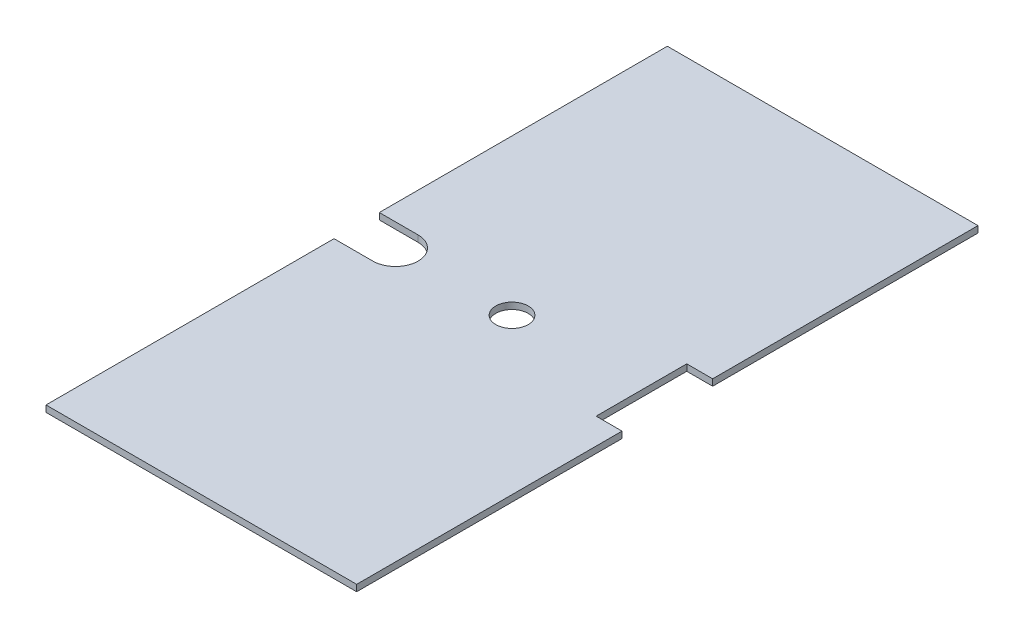
from build123d import *

# Parameters (mm, degrees)
SKETCH1_W           = 609.6
SKETCH1_H           = 1219.2
BOSS_EXTRUDE1_DEPTH = 12.7
SKETCH6_R           = 31.75
CUT_EXTRUDE3_DEPTH  = 682.671834536
SKETCH8_W           = 415.926094716
SKETCH8_H           = 177.8
CUT_EXTRUDE4_DEPTH  = 682.671834536
SKETCH10_W          = 180.418217341
SKETCH10_H          = 88.9
CUT_EXTRUDE7_DEPTH  = 682.671834536
SKETCH14_R          = 44.45
CUT_EXTRUDE8_DEPTH  = 682.671834536


with BuildPart() as part:
    # Sketch1 → Boss-Extrude1 (new body)
    with BuildSketch(Plane(origin=(0, 0, 0), x_dir=(1, 0, 0), z_dir=(0, 1, 0))):
        Rectangle(SKETCH1_W, SKETCH1_H)
    extrude(amount=BOSS_EXTRUDE1_DEPTH)

    # Sketch6 → Cut-Extrude3 (cut, through all)
    with BuildSketch(Plane(origin=(0, 12.7, 0), x_dir=(-1, 0, 0), z_dir=(0, 1, 0))):
        with Locations(Location((0, 0, 0), (0, 0, 90))):
            Circle(SKETCH6_R)
    extrude(amount=-CUT_EXTRUDE3_DEPTH, mode=Mode.SUBTRACT)

    # Sketch8 → Cut-Extrude4 (cut, through all)
    with BuildSketch(Plane(origin=(0, 12.7, 0), x_dir=(1, 0, 0), z_dir=(0, 1, 0))):
        with Locations((461.963047358, 0)):
            Rectangle(SKETCH8_W, SKETCH8_H)
    extrude(amount=-CUT_EXTRUDE4_DEPTH, mode=Mode.SUBTRACT)

    # Sketch10 → Cut-Extrude7 (cut, through all)
    with BuildSketch(Plane(origin=(0, 12.7, 0), x_dir=(1, 0, 0), z_dir=(0, 1, 0))):
        with Locations((-318.80910867, 0)):
            Rectangle(SKETCH10_W, SKETCH10_H)
    extrude(amount=-CUT_EXTRUDE7_DEPTH, mode=Mode.SUBTRACT)

    # Sketch14 → Cut-Extrude8 (cut, through all)
    with BuildSketch(Plane(origin=(0, 12.7, 0), x_dir=(1, 0, 0), z_dir=(0, 1, 0))):
        with Locations((-228.6, 0)):
            Circle(SKETCH14_R)
    extrude(amount=-CUT_EXTRUDE8_DEPTH, mode=Mode.SUBTRACT)


solid = part.part
